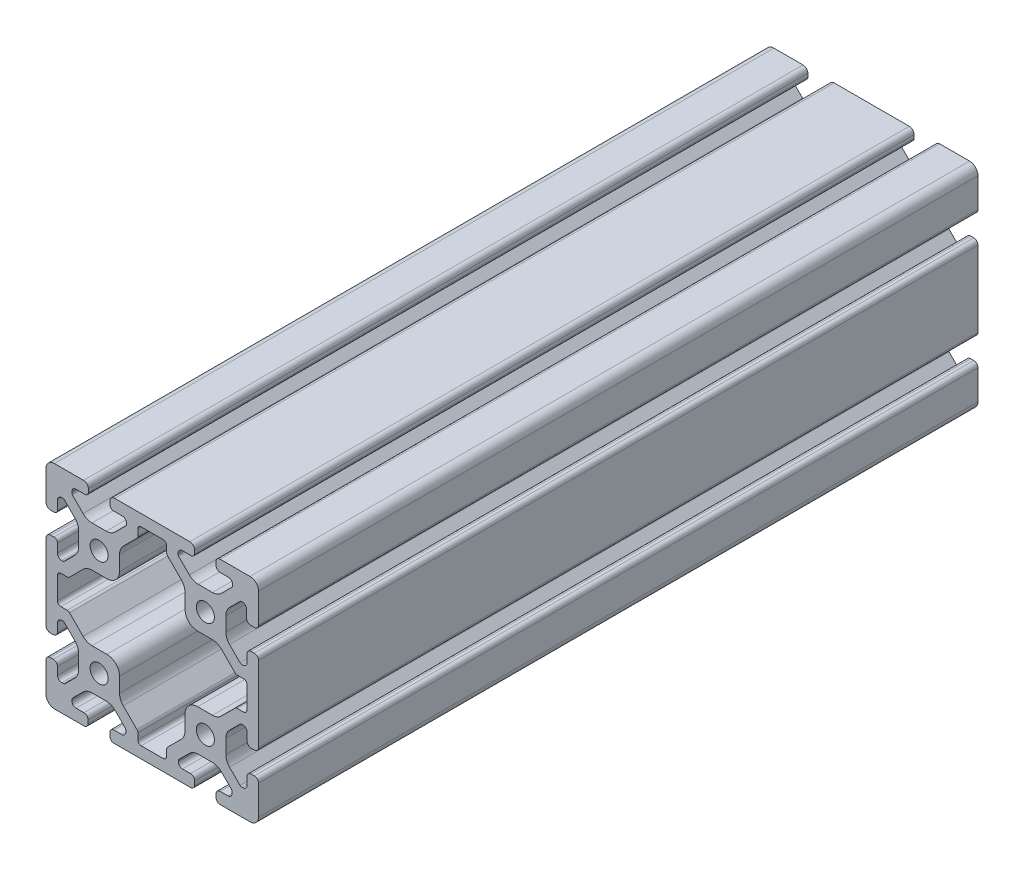
from build123d import *

# Parameters (mm, degrees)
SKETCH1_R      = 3.4
EXTRUDE1_DEPTH = 270.85


with BuildPart() as part:
    # Sketch1 → Extrude1 (new body)
    with BuildSketch(Plane.XY):
        with BuildLine():
            Line((29.091242789, 26.036541495), (33.082657296, 30.027956002))
            ThreePointArc((33.082657296, 30.027956002), (33.329219041, 30.192703293), (33.62005845, 30.250554848))
            Line((33.62005845, 30.250554848), (33.955571436, 30.250554848))
            ThreePointArc((33.955571436, 30.250554848), (35.065729082, 29.790712494), (35.525571436, 28.680554848))
            Line((35.525571436, 28.680554848), (35.525571436, 25.777866899))
            ThreePointArc((35.525571436, 25.777866899), (35.985413789, 24.667709253), (37.095571436, 24.207866899))
            Line((37.095571436, 24.207866899), (38.43, 24.207866899))
            ThreePointArc((38.43, 24.207866899), (39.540157646, 24.667709253), (40, 25.777866899))
            Line((40, 25.777866899), (40, 32.933852749))
            Line((40, 32.933852749), (40, 36.83))
            ThreePointArc((40, 36.83), (39.071528496, 39.071528496), (36.83, 40))
            Line((36.83, 40), (25.540851266, 40))
            ThreePointArc((25.540851266, 40), (24.43069362, 39.540157646), (23.970851266, 38.43))
            Line((23.970851266, 38.43), (23.970851266, 37.249043598))
            ThreePointArc((23.970851266, 37.249043598), (24.43069362, 36.138885952), (25.540851266, 35.679043598))
            Line((25.540851266, 35.679043598), (28.625762638, 35.679043598))
            ThreePointArc((28.625762638, 35.679043598), (29.77116849, 35.239363487), (30.250554848, 34.11))
            Line((30.250554848, 34.11), (30.250554848, 33.62005845))
            ThreePointArc((30.250554848, 33.62005845), (30.192703293, 33.329219041), (30.027956002, 33.082657296))
            Line((30.027956002, 33.082657296), (26.036541495, 29.091242789))
            ThreePointArc((26.036541495, 29.091242789), (24.495530588, 28.061572221), (22.677784284, 27.7))
            Line((22.677784284, 27.7), (17.322215716, 27.7))
            ThreePointArc((17.322215716, 27.7), (15.504469412, 28.061572221), (13.963458505, 29.091242789))
            Line((13.963458505, 29.091242789), (9.90393336, 33.150767934))
            ThreePointArc((9.90393336, 33.150767934), (9.764102181, 33.360040084), (9.715, 33.606893415))
            Line((9.715, 33.606893415), (9.715, 34.096834965))
            ThreePointArc((9.715, 34.096834965), (10.178698303, 35.216301697), (11.298165035, 35.68))
            Line((11.298165035, 35.68), (14.642754087, 35.68))
            ThreePointArc((14.642754087, 35.68), (15.560045469, 36.059954531), (15.94, 36.977245913))
            Line((15.94, 36.977245913), (15.94, 38.194841282))
            ThreePointArc((15.94, 38.194841282), (15.411281253, 39.471281253), (14.134841282, 40))
            Line((14.134841282, 40), (6.984433948, 40))
            Line((6.984433948, 40), (-6.984433948, 40))
            Line((-6.984433948, 40), (-14.134841282, 40))
            ThreePointArc((-14.134841282, 40), (-15.411281253, 39.471281253), (-15.94, 38.194841282))
            Line((-15.94, 38.194841282), (-15.94, 36.977245913))
            ThreePointArc((-15.94, 36.977245913), (-15.560045469, 36.059954531), (-14.642754087, 35.68))
            Line((-14.642754087, 35.68), (-11.298165035, 35.68))
            ThreePointArc((-11.298165035, 35.68), (-10.178698303, 35.216301697), (-9.715, 34.096834965))
            Line((-9.715, 34.096834965), (-9.715, 33.606893415))
            ThreePointArc((-9.715, 33.606893415), (-9.764102181, 33.360040084), (-9.90393336, 33.150767934))
            Line((-9.90393336, 33.150767934), (-13.963458505, 29.091242789))
            ThreePointArc((-13.963458505, 29.091242789), (-15.504469412, 28.061572221), (-17.322215716, 27.7))
            Line((-17.322215716, 27.7), (-22.677784284, 27.7))
            ThreePointArc((-22.677784284, 27.7), (-24.495530588, 28.061572221), (-26.036541495, 29.091242789))
            Line((-26.036541495, 29.091242789), (-30.09606664, 33.150767934))
            ThreePointArc((-30.09606664, 33.150767934), (-30.235897819, 33.360040084), (-30.285, 33.606893415))
            Line((-30.285, 33.606893415), (-30.285, 34.096834965))
            ThreePointArc((-30.285, 34.096834965), (-29.821301697, 35.216301697), (-28.701834965, 35.68))
            Line((-28.701834965, 35.68), (-25.357245913, 35.68))
            ThreePointArc((-25.357245913, 35.68), (-24.439954531, 36.059954531), (-24.06, 36.977245913))
            Line((-24.06, 36.977245913), (-24.06, 38.194841282))
            ThreePointArc((-24.06, 38.194841282), (-24.588718747, 39.471281253), (-25.865158718, 40))
            Line((-25.865158718, 40), (-33.031395847, 40))
            Line((-33.031395847, 40), (-36.83, 40))
            ThreePointArc((-36.83, 40), (-39.071528496, 39.071528496), (-40, 36.83))
            Line((-40, 36.83), (-40, 33.318079463))
            Line((-40, 33.318079463), (-40, 25.865158718))
            ThreePointArc((-40, 25.865158718), (-39.471281253, 24.588718747), (-38.194841282, 24.06))
            Line((-38.194841282, 24.06), (-36.977245913, 24.06))
            ThreePointArc((-36.977245913, 24.06), (-36.059954531, 24.439954531), (-35.68, 25.357245913))
            Line((-35.68, 25.357245913), (-35.68, 28.680554848))
            ThreePointArc((-35.68, 28.680554848), (-35.220157646, 29.790712494), (-34.11, 30.250554848))
            Line((-34.11, 30.250554848), (-33.62005845, 30.250554848))
            ThreePointArc((-33.62005845, 30.250554848), (-33.329219041, 30.192703293), (-33.082657296, 30.027956002))
            Line((-33.082657296, 30.027956002), (-29.091242789, 26.036541495))
            ThreePointArc((-29.091242789, 26.036541495), (-28.061572221, 24.495530588), (-27.7, 22.677784284))
            Line((-27.7, 22.677784284), (-27.7, 17.322215716))
            ThreePointArc((-27.7, 17.322215716), (-28.061572221, 15.504469412), (-29.091242789, 13.963458505))
            Line((-29.091242789, 13.963458505), (-33.082657296, 9.972043998))
            ThreePointArc((-33.082657296, 9.972043998), (-33.329219041, 9.807296707), (-33.62005845, 9.749445152))
            Line((-33.62005845, 9.749445152), (-34.11, 9.749445152))
            ThreePointArc((-34.11, 9.749445152), (-35.220157646, 10.209287506), (-35.68, 11.319445152))
            Line((-35.68, 11.319445152), (-35.68, 14.642754087))
            ThreePointArc((-35.68, 14.642754087), (-36.059954531, 15.560045469), (-36.977245913, 15.94))
            Line((-36.977245913, 15.94), (-38.194841282, 15.94))
            ThreePointArc((-38.194841282, 15.94), (-39.471281253, 15.411281253), (-40, 14.134841282))
            Line((-40, 14.134841282), (-40, 7.016888977))
            Line((-40, 7.016888977), (-40, -7.016888977))
            Line((-40, -7.016888977), (-40, -14.447338303))
            ThreePointArc((-40, -14.447338303), (-39.540157646, -15.557495949), (-38.43, -16.017338303))
            Line((-38.43, -16.017338303), (-37.25, -16.017338303))
            ThreePointArc((-37.25, -16.017338303), (-36.139842354, -15.557495949), (-35.68, -14.447338303))
            Line((-35.68, -14.447338303), (-35.68, -11.319445152))
            ThreePointArc((-35.68, -11.319445152), (-35.220157646, -10.209287506), (-34.11, -9.749445152))
            Line((-34.11, -9.749445152), (-33.62005845, -9.749445152))
            ThreePointArc((-33.62005845, -9.749445152), (-33.329219041, -9.807296707), (-33.082657296, -9.972043998))
            Line((-33.082657296, -9.972043998), (-29.091242789, -13.963458505))
            ThreePointArc((-29.091242789, -13.963458505), (-28.061572221, -15.504469412), (-27.7, -17.322215716))
            Line((-27.7, -17.322215716), (-27.7, -22.677784284))
            ThreePointArc((-27.7, -22.677784284), (-28.061572221, -24.495530588), (-29.091242789, -26.036541495))
            Line((-29.091242789, -26.036541495), (-32.871776968, -29.817075674))
            ThreePointArc((-32.871776968, -29.817075674), (-33.10612883, -29.976640176), (-33.382654504, -30.039211548))
            Line((-33.382654504, -30.039211548), (-34.05520779, -30.062697627))
            ThreePointArc((-34.05520779, -30.062697627), (-35.200613642, -29.623017515), (-35.68, -28.493654028))
            Line((-35.68, -28.493654028), (-35.68, -25.59096608))
            ThreePointArc((-35.68, -25.59096608), (-36.139842354, -24.480808433), (-37.25, -24.02096608))
            Line((-37.25, -24.02096608), (-38.43, -24.02096608))
            ThreePointArc((-38.43, -24.02096608), (-39.540157646, -24.480808433), (-40, -25.59096608))
            Line((-40, -25.59096608), (-40, -33.019082273))
            Line((-40, -33.019082273), (-40, -36.83))
            ThreePointArc((-40, -36.83), (-39.071528496, -39.071528496), (-36.83, -40))
            Line((-36.83, -40), (-33, -40))
            Line((-33, -40), (-25.72307469, -40))
            ThreePointArc((-25.72307469, -40), (-24.612917043, -39.540157646), (-24.15307469, -38.43))
            Line((-24.15307469, -38.43), (-24.15307469, -37.25))
            ThreePointArc((-24.15307469, -37.25), (-24.612917043, -36.139842354), (-25.72307469, -35.68))
            Line((-25.72307469, -35.68), (-28.680554848, -35.68))
            ThreePointArc((-28.680554848, -35.68), (-29.790712494, -35.220157646), (-30.250554848, -34.11))
            Line((-30.250554848, -34.11), (-30.250554848, -33.62005845))
            ThreePointArc((-30.250554848, -33.62005845), (-30.192703293, -33.329219041), (-30.027956002, -33.082657296))
            Line((-30.027956002, -33.082657296), (-26.036541495, -29.091242789))
            ThreePointArc((-26.036541495, -29.091242789), (-24.495530588, -28.061572221), (-22.677784284, -27.7))
            Line((-22.677784284, -27.7), (-17.322215716, -27.7))
            ThreePointArc((-17.322215716, -27.7), (-15.504469412, -28.061572221), (-13.963458505, -29.091242789))
            Line((-13.963458505, -29.091242789), (-10.203784275, -32.85091702))
            ThreePointArc((-10.203784275, -32.85091702), (-10.044219772, -33.085268882), (-9.9816484, -33.361794556))
            Line((-9.9816484, -33.361794556), (-9.957433876, -34.05520779))
            ThreePointArc((-9.957433876, -34.05520779), (-10.397113988, -35.200613642), (-11.526477474, -35.68))
            Line((-11.526477474, -35.68), (-14.429165423, -35.68))
            ThreePointArc((-14.429165423, -35.68), (-15.539323069, -36.139842354), (-15.999165423, -37.25))
            Line((-15.999165423, -37.25), (-15.999165423, -38.43))
            ThreePointArc((-15.999165423, -38.43), (-15.539323069, -39.540157646), (-14.429165423, -40))
            Line((-14.429165423, -40), (-6.998716097, -40))
            Line((-6.998716097, -40), (6.998716097, -40))
            Line((6.998716097, -40), (14.424638994, -40))
            ThreePointArc((14.424638994, -40), (15.53479664, -39.540157646), (15.994638994, -38.43))
            Line((15.994638994, -38.43), (15.994638994, -37.032644306))
            ThreePointArc((15.994638994, -37.032644306), (15.53479664, -35.922486659), (14.424638994, -35.462644306))
            Line((14.424638994, -35.462644306), (11.382372282, -35.462644306))
            ThreePointArc((11.382372282, -35.462644306), (10.272214636, -35.002801952), (9.812372282, -33.892644306))
            Line((9.812372282, -33.892644306), (9.812372282, -33.55713132))
            ThreePointArc((9.812372282, -33.55713132), (9.870223837, -33.266291912), (10.034971128, -33.019730166))
            Line((10.034971128, -33.019730166), (13.963458505, -29.091242789))
            ThreePointArc((13.963458505, -29.091242789), (15.504469412, -28.061572221), (17.322215716, -27.7))
            Line((17.322215716, -27.7), (22.677784284, -27.7))
            ThreePointArc((22.677784284, -27.7), (24.495530588, -28.061572221), (26.036541495, -29.091242789))
            Line((26.036541495, -29.091242789), (29.794925243, -32.849626538))
            ThreePointArc((29.794925243, -32.849626538), (29.954489746, -33.083978399), (30.017061118, -33.360504074))
            Line((30.017061118, -33.360504074), (30.041320706, -34.05520779))
            ThreePointArc((30.041320706, -34.05520779), (29.601640594, -35.200613642), (28.472277108, -35.68))
            Line((28.472277108, -35.68), (25.569589159, -35.68))
            ThreePointArc((25.569589159, -35.68), (24.459431513, -36.139842354), (23.999589159, -37.25))
            Line((23.999589159, -37.25), (23.999589159, -38.43))
            ThreePointArc((23.999589159, -38.43), (24.459431513, -39.540157646), (25.569589159, -40))
            Line((25.569589159, -40), (32.999849358, -40))
            Line((32.999849358, -40), (36.83, -40))
            ThreePointArc((36.83, -40), (39.071528496, -39.071528496), (40, -36.83))
            Line((40, -36.83), (40, -33.025941835))
            Line((40, -33.025941835), (40, -25.777866899))
            ThreePointArc((40, -25.777866899), (39.540157646, -24.667709253), (38.43, -24.207866899))
            Line((38.43, -24.207866899), (37.25, -24.207866899))
            ThreePointArc((37.25, -24.207866899), (36.139842354, -24.667709253), (35.68, -25.777866899))
            Line((35.68, -25.777866899), (35.68, -28.680554848))
            ThreePointArc((35.68, -28.680554848), (35.220157646, -29.790712494), (34.11, -30.250554848))
            Line((34.11, -30.250554848), (33.62005845, -30.250554848))
            ThreePointArc((33.62005845, -30.250554848), (33.329219041, -30.192703293), (33.082657296, -30.027956002))
            Line((33.082657296, -30.027956002), (29.091242789, -26.036541495))
            ThreePointArc((29.091242789, -26.036541495), (28.061572221, -24.495530588), (27.7, -22.677784284))
            Line((27.7, -22.677784284), (27.7, -17.322215716))
            ThreePointArc((27.7, -17.322215716), (28.061572221, -15.504469412), (29.091242789, -13.963458505))
            Line((29.091242789, -13.963458505), (33.082657296, -9.972043998))
            ThreePointArc((33.082657296, -9.972043998), (33.329219041, -9.807296707), (33.62005845, -9.749445152))
            Line((33.62005845, -9.749445152), (34.11, -9.749445152))
            ThreePointArc((34.11, -9.749445152), (35.220157646, -10.209287506), (35.68, -11.319445152))
            Line((35.68, -11.319445152), (35.68, -14.222133101))
            ThreePointArc((35.68, -14.222133101), (36.139842354, -15.332290747), (37.25, -15.792133101))
            Line((37.25, -15.792133101), (38.43, -15.792133101))
            ThreePointArc((38.43, -15.792133101), (39.540157646, -15.332290747), (40, -14.222133101))
            Line((40, -14.222133101), (40, -7.021415406))
            Line((40, -7.021415406), (40, 7.021415406))
            Line((40, 7.021415406), (40, 14.222133101))
            ThreePointArc((40, 14.222133101), (39.540157646, 15.332290747), (38.43, 15.792133101))
            Line((38.43, 15.792133101), (37.25, 15.792133101))
            ThreePointArc((37.25, 15.792133101), (36.139842354, 15.332290747), (35.68, 14.222133101))
            Line((35.68, 14.222133101), (35.68, 11.319445152))
            ThreePointArc((35.68, 11.319445152), (35.220157646, 10.209287506), (34.11, 9.749445152))
            Line((34.11, 9.749445152), (33.62005845, 9.749445152))
            ThreePointArc((33.62005845, 9.749445152), (33.329219041, 9.807296707), (33.082657296, 9.972043998))
            Line((33.082657296, 9.972043998), (29.091242789, 13.963458505))
            ThreePointArc((29.091242789, 13.963458505), (28.061572221, 15.504469412), (27.7, 17.322215716))
            Line((27.7, 17.322215716), (27.7, 22.677784284))
            ThreePointArc((27.7, 22.677784284), (28.061572221, 24.495530588), (29.091242789, 26.036541495))
        make_face()
        with Locations((-20, 20)):
            Circle(SKETCH1_R, mode=Mode.SUBTRACT)
        with Locations((20, 20)):
            Circle(SKETCH1_R, mode=Mode.SUBTRACT)
        with Locations((20, -20)):
            Circle(SKETCH1_R, mode=Mode.SUBTRACT)
        with Locations((-20, -20)):
            Circle(SKETCH1_R, mode=Mode.SUBTRACT)
        with BuildLine():
            Line((17.07, 12.32), (22.657784284, 12.32))
            ThreePointArc((22.657784284, 12.32), (24.475530588, 11.958427779), (26.016541495, 10.928757211))
            Line((26.016541495, 10.928757211), (31.143879165, 5.80141954))
            ThreePointArc((31.143879165, 5.80141954), (31.555896818, 5.526118146), (32.041904777, 5.429445152))
            Line((32.041904777, 5.429445152), (34.41, 5.429445152))
            ThreePointArc((34.41, 5.429445152), (35.308025612, 5.057470764), (35.68, 4.159445152))
            Line((35.68, 4.159445152), (35.68, -4.159445152))
            ThreePointArc((35.68, -4.159445152), (35.308025612, -5.057470764), (34.41, -5.429445152))
            Line((34.41, -5.429445152), (32.041904777, -5.429445152))
            ThreePointArc((32.041904777, -5.429445152), (31.555896818, -5.526118146), (31.143879165, -5.80141954))
            Line((31.143879165, -5.80141954), (26.016541495, -10.928757211))
            ThreePointArc((26.016541495, -10.928757211), (24.475530588, -11.958427779), (22.657784284, -12.32))
            Line((22.657784284, -12.32), (17.07, -12.32))
            ThreePointArc((17.07, -12.32), (13.711242789, -13.711242789), (12.32, -17.07))
            Line((12.32, -17.07), (12.32, -22.657784284))
            ThreePointArc((12.32, -22.657784284), (11.958427779, -24.475530588), (10.928757211, -26.016541495))
            Line((10.928757211, -26.016541495), (5.80141954, -31.143879165))
            ThreePointArc((5.80141954, -31.143879165), (5.526118146, -31.555896818), (5.429445152, -32.041904777))
            Line((5.429445152, -32.041904777), (5.429445152, -34.41))
            ThreePointArc((5.429445152, -34.41), (5.057470764, -35.308025612), (4.159445152, -35.68))
            Line((4.159445152, -35.68), (-4.159445152, -35.68))
            ThreePointArc((-4.159445152, -35.68), (-5.057470764, -35.308025612), (-5.429445152, -34.41))
            Line((-5.429445152, -34.41), (-5.429445152, -32.041904777))
            ThreePointArc((-5.429445152, -32.041904777), (-5.526118146, -31.555896818), (-5.80141954, -31.143879165))
            Line((-5.80141954, -31.143879165), (-10.928757211, -26.016541495))
            ThreePointArc((-10.928757211, -26.016541495), (-11.958427779, -24.475530588), (-12.32, -22.657784284))
            Line((-12.32, -22.657784284), (-12.32, -17.07))
            ThreePointArc((-12.32, -17.07), (-13.711242789, -13.711242789), (-17.07, -12.32))
            Line((-17.07, -12.32), (-22.657784284, -12.32))
            ThreePointArc((-22.657784284, -12.32), (-24.475530588, -11.958427779), (-26.016541495, -10.928757211))
            Line((-26.016541495, -10.928757211), (-31.143879165, -5.80141954))
            ThreePointArc((-31.143879165, -5.80141954), (-31.555896818, -5.526118146), (-32.041904777, -5.429445152))
            Line((-32.041904777, -5.429445152), (-34.41, -5.429445152))
            ThreePointArc((-34.41, -5.429445152), (-35.308025612, -5.057470764), (-35.68, -4.159445152))
            Line((-35.68, -4.159445152), (-35.68, 4.159445152))
            ThreePointArc((-35.68, 4.159445152), (-35.308025612, 5.057470764), (-34.41, 5.429445152))
            Line((-34.41, 5.429445152), (-32.041904777, 5.429445152))
            ThreePointArc((-32.041904777, 5.429445152), (-31.555896818, 5.526118146), (-31.143879165, 5.80141954))
            Line((-31.143879165, 5.80141954), (-26.016541495, 10.928757211))
            ThreePointArc((-26.016541495, 10.928757211), (-24.475530588, 11.958427779), (-22.657784284, 12.32))
            Line((-22.657784284, 12.32), (-17.07, 12.32))
            ThreePointArc((-17.07, 12.32), (-13.711242789, 13.711242789), (-12.32, 17.07))
            Line((-12.32, 17.07), (-12.32, 22.657784284))
            ThreePointArc((-12.32, 22.657784284), (-11.958427779, 24.475530588), (-10.928757211, 26.016541495))
            Line((-10.928757211, 26.016541495), (-5.80141954, 31.143879165))
            ThreePointArc((-5.80141954, 31.143879165), (-5.526118146, 31.555896818), (-5.429445152, 32.041904777))
            Line((-5.429445152, 32.041904777), (-5.429445152, 34.41))
            ThreePointArc((-5.429445152, 34.41), (-5.057470764, 35.308025612), (-4.159445152, 35.68))
            Line((-4.159445152, 35.68), (4.159445152, 35.68))
            ThreePointArc((4.159445152, 35.68), (5.057470764, 35.308025612), (5.429445152, 34.41))
            Line((5.429445152, 34.41), (5.429445152, 32.041904777))
            ThreePointArc((5.429445152, 32.041904777), (5.526118146, 31.555896818), (5.80141954, 31.143879165))
            Line((5.80141954, 31.143879165), (10.928757211, 26.016541495))
            ThreePointArc((10.928757211, 26.016541495), (11.958427779, 24.475530588), (12.32, 22.657784284))
            Line((12.32, 22.657784284), (12.32, 17.07))
            ThreePointArc((12.32, 17.07), (13.711242789, 13.711242789), (17.07, 12.32))
        make_face(mode=Mode.SUBTRACT)
    extrude(amount=-EXTRUDE1_DEPTH)


solid = part.part
